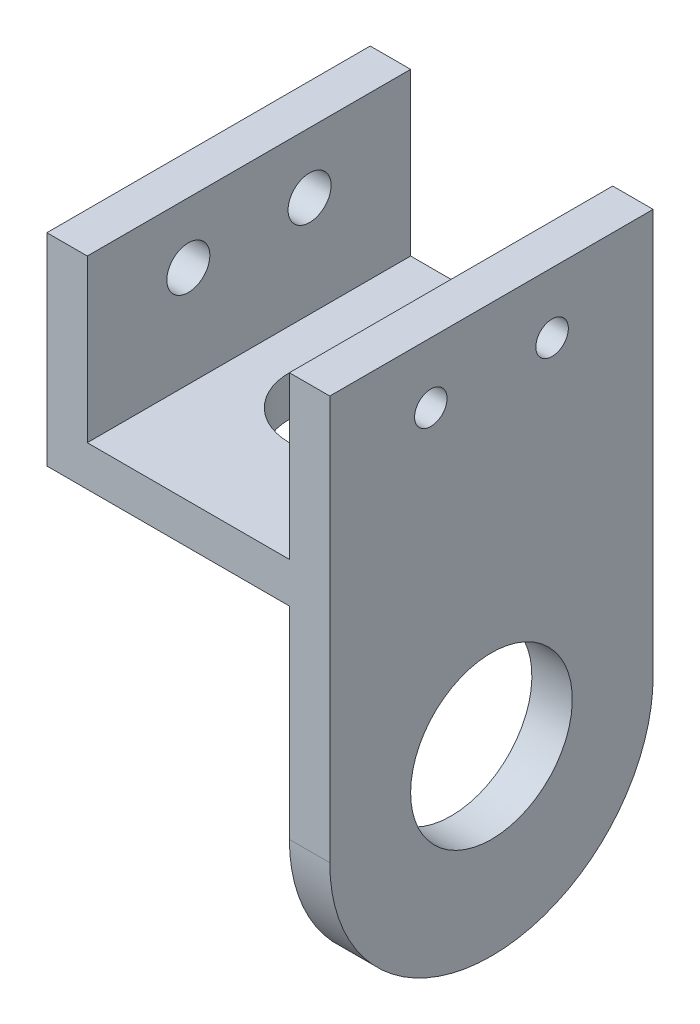
from build123d import *

# Parameters (mm, degrees)
BOSS_EXTRUDE1_DEPTH         = 50.8
SKETCH2_R                   = 12.7
CUT_EXTRUDE1_DEPTH          = 44.45
F_1_4_20_TAPPED_HOLE1_D     = 5.1054
F_1_4_20_TAPPED_HOLE1_DEPTH = 6.35
SKETCH5_R                   = 3.3782
CUT_EXTRUDE2_DEPTH          = 8.89
SKETCH6_R                   = 9.525
CUT_EXTRUDE3_DEPTH          = 8.89
FILLET1_RADIUS              = 25.4
FILLET1_LENGTH              = 6.35


with BuildPart() as part:
    # Sketch1 → Boss-Extrude1 (new body)
    with BuildSketch(Plane.XY):
        Polygon((0, 0), (6.35, 0), (6.35, 88.9), (0, 88.9), (0, 63.5), (-31.75, 63.5), (-31.75, 88.9), (-38.1, 88.9), (-38.1, 57.15), (0, 57.15), align=None)
    extrude(amount=BOSS_EXTRUDE1_DEPTH)

    # Sketch2 → Cut-Extrude1 (cut)
    with BuildSketch(Plane.ZY):
        with Locations(Location((25.4, 28.575, 0), (0, 0, 270))):
            Circle(SKETCH2_R)
    extrude(amount=-CUT_EXTRUDE1_DEPTH, mode=Mode.SUBTRACT)

    # 1/4-20 Tapped Hole1
    with Locations(Plane.ZY):
        with Locations((15.875, 79.375), (34.925, 79.375)):
            Hole(F_1_4_20_TAPPED_HOLE1_D / 2, depth=F_1_4_20_TAPPED_HOLE1_DEPTH)

    # Sketch5 → Cut-Extrude2 (cut)
    with BuildSketch(Plane.ZY.offset(38.1)):
        with Locations((15.875, 79.375)):
            Circle(SKETCH5_R)
        with Locations((34.925, 79.375)):
            Circle(SKETCH5_R)
    extrude(amount=-CUT_EXTRUDE2_DEPTH, mode=Mode.SUBTRACT)

    # Sketch6 → Cut-Extrude3 (cut)
    with BuildSketch(Plane(origin=(0, 63.5, 0), x_dir=(1, 0, 0), z_dir=(0, 1, 0))):
        with Locations(Location((-15.875, -25.4, 0), (0, 0, 270))):
            Circle(SKETCH6_R)
    extrude(amount=-CUT_EXTRUDE3_DEPTH, mode=Mode.SUBTRACT)

    # Fillet1: full round fillet: the end face becomes a half cylinder, R = half its width
    fillet1_face = Plane((3.175, 0, 25.4), x_dir=(1, 0, 0), z_dir=(0, -1, 0))  # on the end face: x along it, z out of the body
    fillet1_slab = fillet1_face.offset(-FILLET1_RADIUS / 2) * Box(FILLET1_LENGTH, 2 * FILLET1_RADIUS, FILLET1_RADIUS, mode=Mode.PRIVATE)  # the body's end, R deep
    fillet1_round = Plane((3.175, 25.4, 25.4), x_dir=(0, -1, 0), z_dir=(1, 0, 0)) * Cylinder(FILLET1_RADIUS, FILLET1_LENGTH, mode=Mode.PRIVATE)  # its axis R under the face
    add(fillet1_slab - fillet1_round, mode=Mode.SUBTRACT)


solid = part.part
